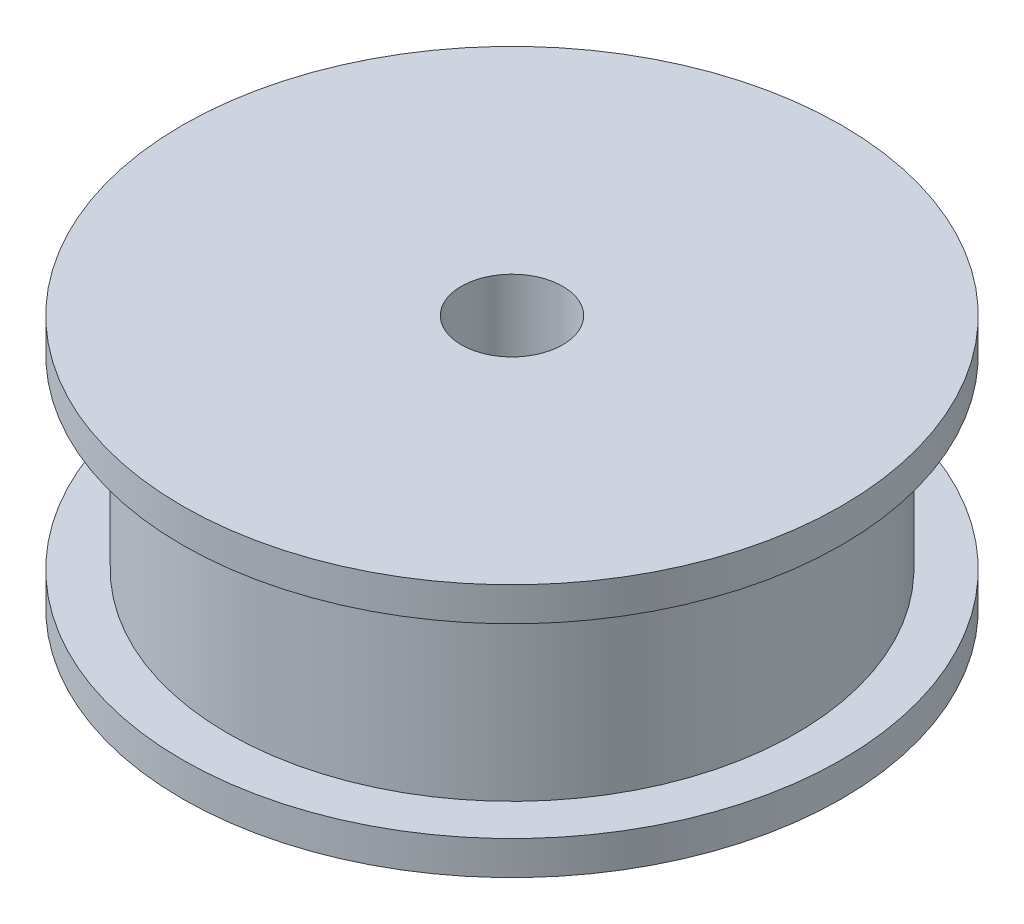
from build123d import *

# Parameters (mm, degrees)
SKETCH_2_R          = 3
CUT_EXTRUDE_1_DEPTH = 32.392674305


with BuildPart() as part:
    # 草图1 → 旋转1 (revolve)
    with BuildSketch(Plane.XY, mode=Mode.PRIVATE) as revolve_1_sk:
        Polygon((0, 0), (19.5, 0), (19.5, -2), (16.805, -2), (16.805, -13), (19.5, -13), (19.5, -15), (0, -15), align=None)
    revolve(revolve_1_sk.sketch.rotate(Axis((0, 23.575757576, 0), (0, -1, 0)), 90), axis=Axis((0, 23.575757576, 0), (0, -1, 0)))

    # 草图2 → 切除-拉伸1 (cut, through all)
    with BuildSketch(Plane(origin=(0, 0, 0), x_dir=(1, 0, 0), z_dir=(0, 1, 0))):
        with Locations(Location((0, 0, 0), (0, 0, 270))):
            Circle(SKETCH_2_R)
    extrude(amount=-CUT_EXTRUDE_1_DEPTH, mode=Mode.SUBTRACT)


solid = part.part
